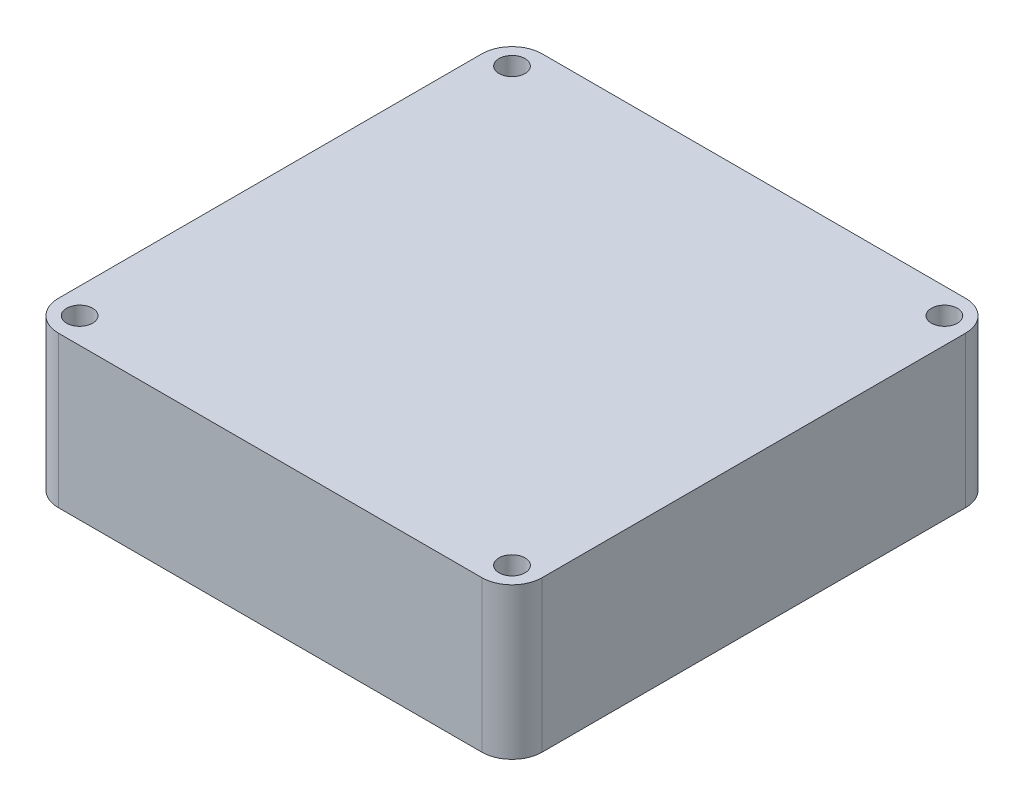
from build123d import *

# Parameters (mm, degrees)
SKETCH_1_W      = 80
SKETCH_1_H      = 80
SKETCH_1_R      = 2.15
EXTRUDE_1_DEPTH = 25
FILLET_1_R      = 5


with BuildPart() as part:
    # ｽｹｯﾁ1 → ﾎﾞｽ - 押し出し1 (new body)
    with BuildSketch(Plane(origin=(0, 0, 0), x_dir=(1, 0, 0), z_dir=(0, 1, 0))):
        Rectangle(SKETCH_1_W, SKETCH_1_H)
        with Locations(Location((35.75, 35.75, 0), (0, 0, 270))):
            Circle(SKETCH_1_R, mode=Mode.SUBTRACT)
        with Locations(Location((35.75, -35.75, 0), (0, 0, 270))):
            Circle(SKETCH_1_R, mode=Mode.SUBTRACT)
        with Locations(Location((-35.75, -35.75, 0), (0, 0, 270))):
            Circle(SKETCH_1_R, mode=Mode.SUBTRACT)
        with Locations(Location((-35.75, 35.75, 0), (0, 0, 270))):
            Circle(SKETCH_1_R, mode=Mode.SUBTRACT)
    extrude(amount=EXTRUDE_1_DEPTH)

    # ﾌｨﾚｯﾄ1
    fillet_1_edges = [part.edges().sort_by_distance(p)[0] for p in [
        (40, 12.5, 40),
        (-40, 12.5, 40),
        (-40, 12.5, -40),
        (40, 12.5, -40),
    ]]
    fillet(fillet_1_edges, radius=FILLET_1_R)


solid = part.part
